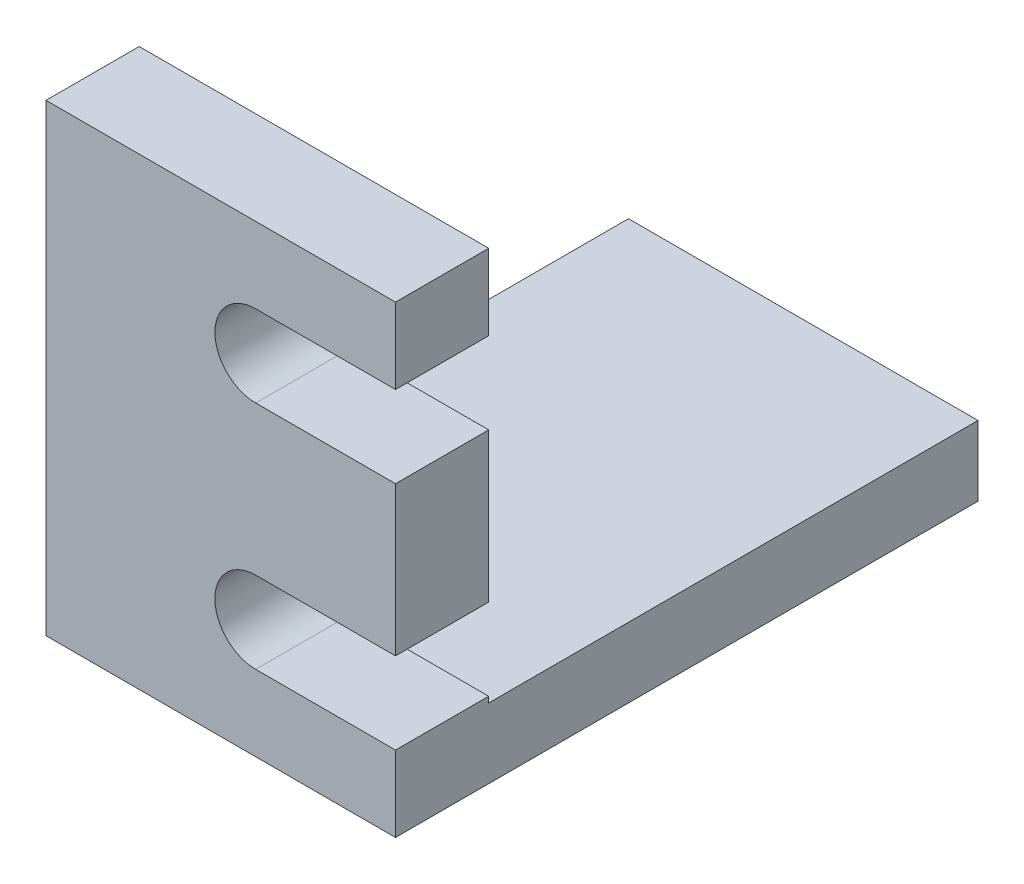
from build123d import *

# Parameters (mm, degrees)
ESTRUSIONE_ESTRUSIONE1_DEPTH = 4
SCHIZZO2_W                   = 15
SCHIZZO2_H                   = 3
ESTRUSIONE_ESTRUSIONE2_DEPTH = 21


with BuildPart() as part:
    # Schizzo1 → Estrusione-Estrusione1 (new body)
    with BuildSketch(Plane.XY):
        with BuildLine():
            Line((0, 19.9), (0, 0))
            Line((0, 0), (15, 0))
            Line((15, 0), (15, 3.25))
            Line((15, 3.25), (9, 3.25))
            ThreePointArc((9, 3.25), (7.25, 5), (9, 6.75))
            Line((9, 6.75), (15, 6.75))
            Line((15, 6.75), (15, 13.15))
            Line((15, 13.15), (9, 13.15))
            ThreePointArc((9, 13.15), (7.25, 14.9), (9, 16.65))
            Line((9, 16.65), (15, 16.65))
            Line((15, 16.65), (15, 19.9))
            Line((15, 19.9), (0, 19.9))
        make_face()
    extrude(amount=ESTRUSIONE_ESTRUSIONE1_DEPTH)

    # Schizzo2 → Estrusione-Estrusione2 (add)
    with BuildSketch(Plane(origin=(0, 0, 0), x_dir=(-1, 0, 0), z_dir=(0, 0, -1))):
        with Locations((-7.5, 1.5)):
            Rectangle(SCHIZZO2_W, SCHIZZO2_H)
    extrude(amount=ESTRUSIONE_ESTRUSIONE2_DEPTH)


solid = part.part
